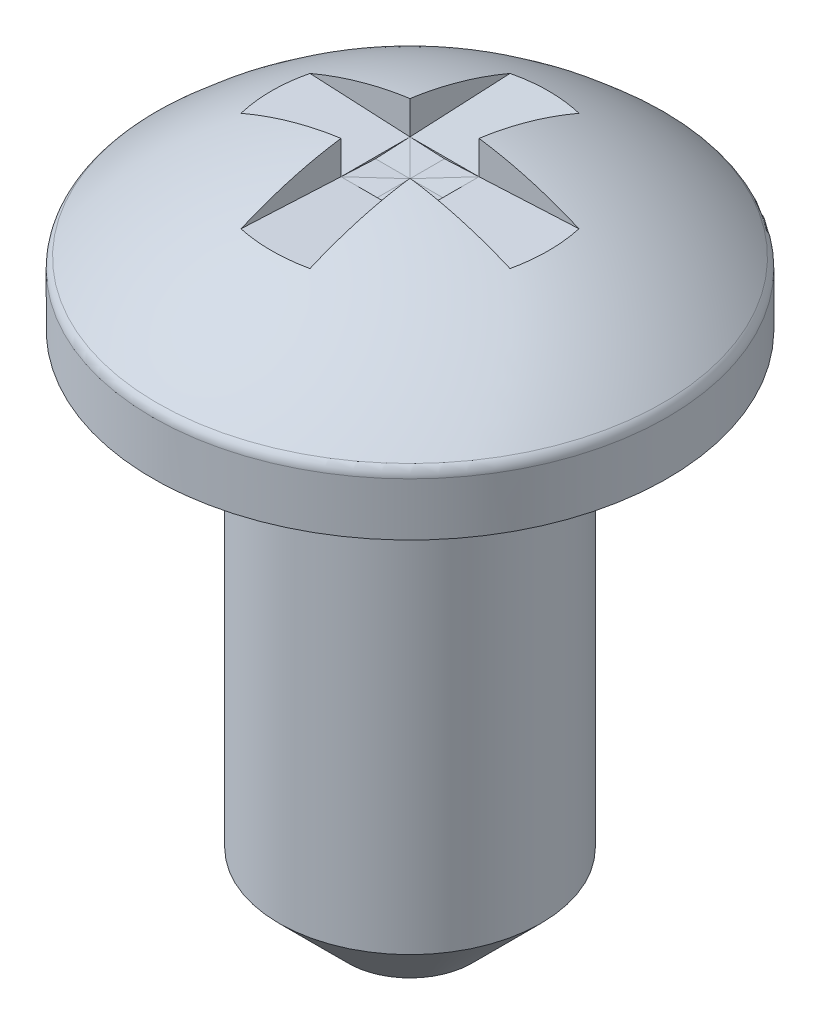
from build123d import *

# Parameters (mm, degrees)
BOSS_EXTRUDE1_DEPTH = 0.635
CIRPATTERN1_COUNT   = 4
FILLET1_R           = 0.254
CHAMFER1_SIZE       = 1.27


with BuildPart() as part:
    # Sketch1 → Revolve1 (revolve)
    with BuildSketch(Plane.XY, mode=Mode.PRIVATE) as revolve1_sk:
        with BuildLine():
            Line((0, 0), (2.413, 0))
            Line((2.413, 0), (2.413, 9.525))
            Line((2.413, 9.525), (4.7371, 9.525))
            Line((4.7371, 9.525), (4.7371, 10.611002179))
            ThreePointArc((4.7371, 10.611002179), (2.548848552, 12.064353728), (0, 12.7))
            Line((0, 12.7), (0, 0))
        make_face()
    revolve(revolve1_sk.sketch.rotate(Axis((0, 0, 0), (0, 1, 0)), 90), axis=Axis((0, 0, 0), (0, 1, 0)))

    # Sketch2 → Boss-Extrude1 (cut, symmetric)
    with BuildSketch(Plane.XY):
        with BuildLine():
            Line((0, 12.7), (0, 11.938))
            Line((0, 11.938), (2.548848552, 12.064353728))
            ThreePointArc((2.548848552, 12.064353728), (1.301653808, 12.491363305), (0, 12.7))
        make_face()
    boss_extrude1 = extrude(amount=BOSS_EXTRUDE1_DEPTH, both=True, mode=Mode.SUBTRACT)

    # CirPattern1: Boss-Extrude1 ×4 about axis
    cirpattern1_axis = Axis((0, 0, 0), (0, 1, 0))
    for i in range(1, CIRPATTERN1_COUNT):
        add(boss_extrude1.rotate(cirpattern1_axis, i * 360 / CIRPATTERN1_COUNT), mode=Mode.SUBTRACT)

    # Fillet1
    fillet1_edges = [part.edges().sort_by_distance(p)[0] for p in [
        (0, 10.611002179, 4.7371),
    ]]
    fillet(fillet1_edges, radius=FILLET1_R)

    # Chamfer1
    chamfer1_edges = [part.edges().sort_by_distance(p)[0] for p in [
        (0, 0, 2.413),
    ]]
    chamfer(chamfer1_edges, length=CHAMFER1_SIZE)


solid = part.part
